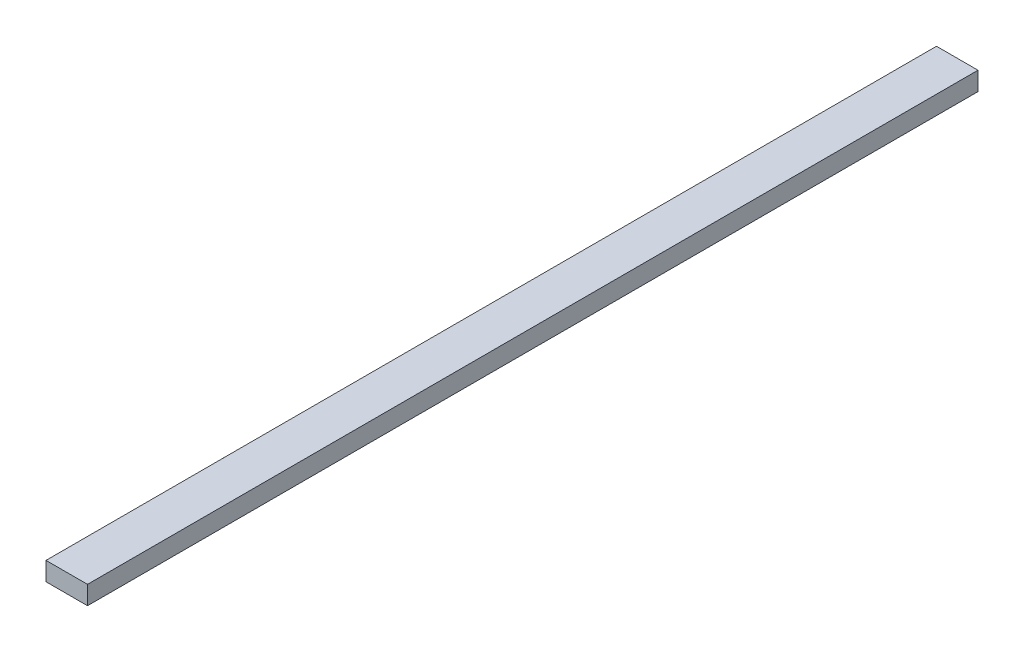
from build123d import *

# Parameters (mm, degrees)
SKETCH1_W           = 16.6624
SKETCH1_H           = 37.2872
BOSS_EXTRUDE1_DEPTH = 400


with BuildPart() as part:
    # Sketch1 → Boss-Extrude1 (new, symmetric)
    with BuildSketch(Plane(origin=(0, 0, 0), x_dir=(0, 1, 0), z_dir=(0, 0, 1))):
        Rectangle(SKETCH1_W, SKETCH1_H)
    extrude(amount=BOSS_EXTRUDE1_DEPTH, both=True)


solid = part.part
